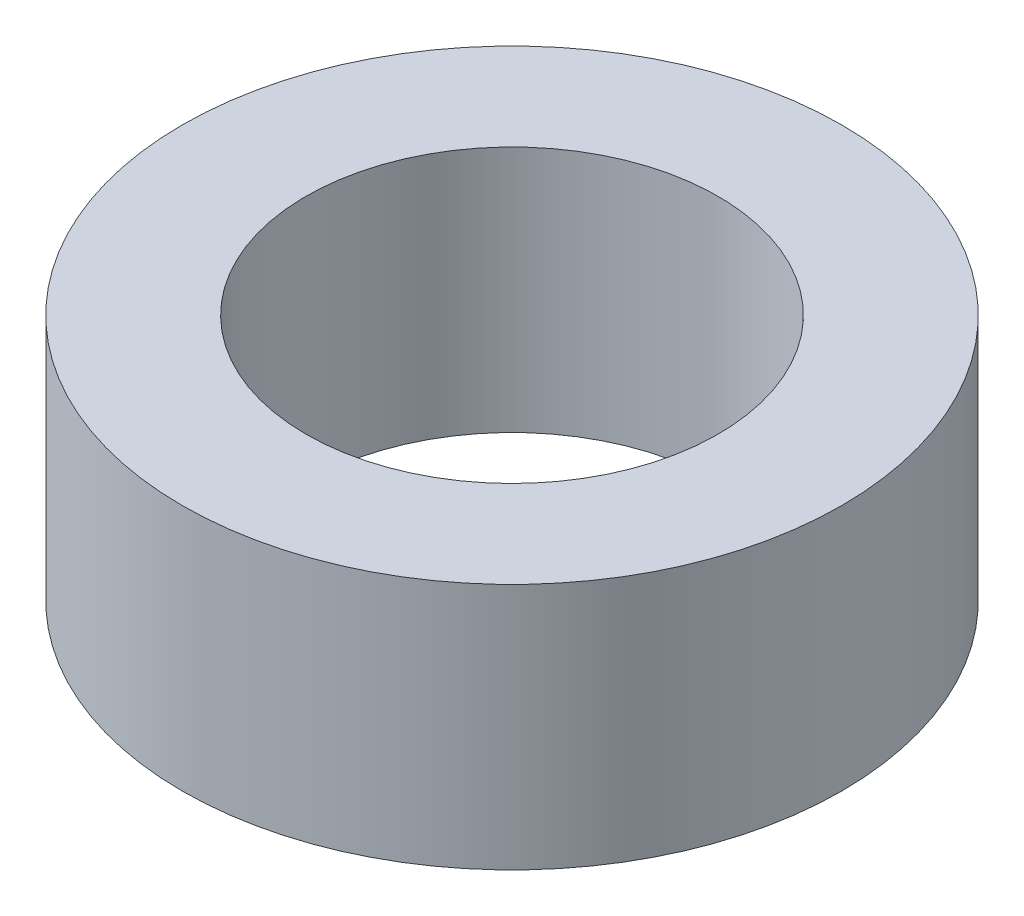
from build123d import *

# Parameters (mm, degrees)
SKETCH1_R           = 8
SKETCH1_R_2         = 5
BOSS_EXTRUDE1_DEPTH = 6


with BuildPart() as part:
    # Sketch1 → Boss-Extrude1 (new body)
    with BuildSketch(Plane(origin=(0, 0, 0), x_dir=(1, 0, 0), z_dir=(0, 1, 0))):
        with Locations(Location((0, 0, 0), (0, 0, 270))):
            Circle(SKETCH1_R)
        with Locations(Location((0, 0, 0), (0, 0, 270))):
            Circle(SKETCH1_R_2, mode=Mode.SUBTRACT)
    extrude(amount=BOSS_EXTRUDE1_DEPTH)


solid = part.part
